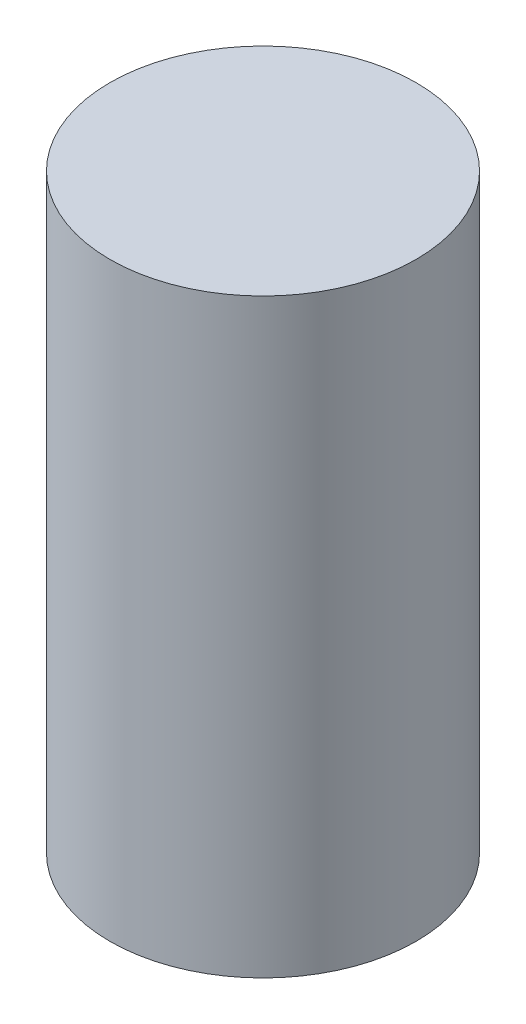
from build123d import *

# Parameters (mm, degrees)
SKETCH1_R           = 3.5
BOSS_EXTRUDE1_DEPTH = 13.5


with BuildPart() as part:
    # Sketch1 → Boss-Extrude1 (new body)
    with BuildSketch(Plane(origin=(0, 0, 0), x_dir=(1, 0, 0), z_dir=(0, 1, 0))):
        Circle(SKETCH1_R)
    extrude(amount=BOSS_EXTRUDE1_DEPTH)


solid = part.part
